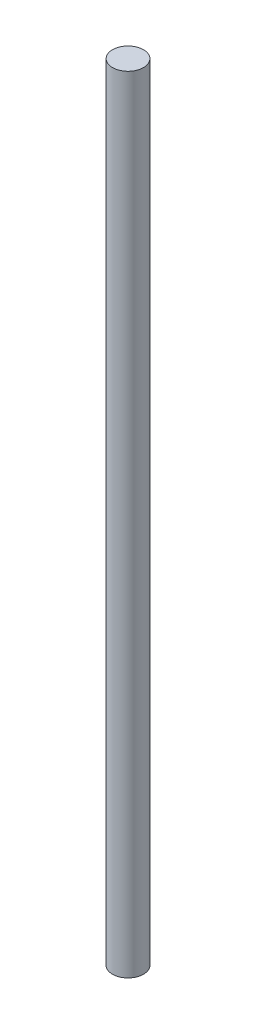
from build123d import *

# Parameters (mm, degrees)
SKETCH2_R           = 4.7625
BOSS_EXTRUDE1_DEPTH = 241.3


with BuildPart() as part:
    # Sketch2 → Boss-Extrude1 (new body)
    with BuildSketch(Plane(origin=(0, 0, 0), x_dir=(1, 0, 0), z_dir=(0, 1, 0))):
        with Locations(Location((0, 0, 0), (0, 0, 90))):
            Circle(SKETCH2_R)
    extrude(amount=BOSS_EXTRUDE1_DEPTH)


solid = part.part
